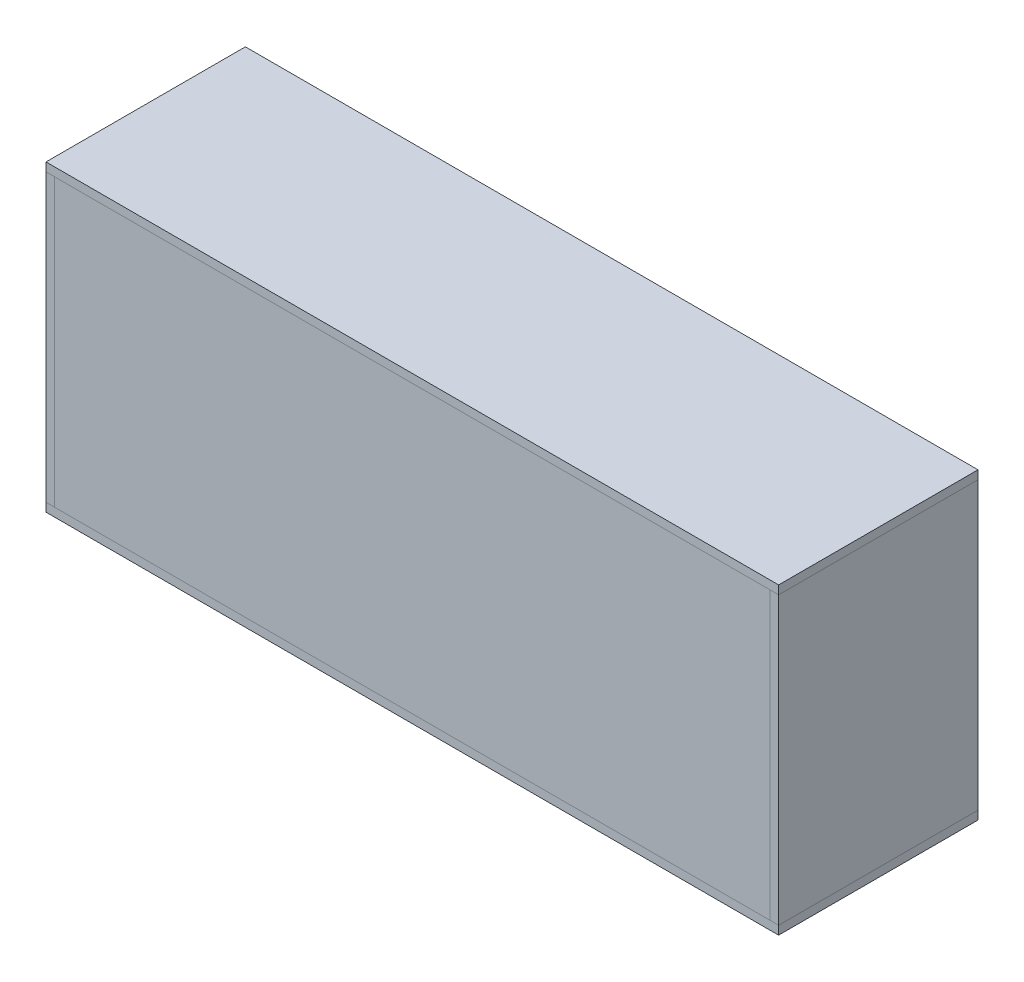
from build123d import *

# Parameters (mm, degrees)
ESQUISSE1_W             = 1536
ESQUISSE1_H             = 418
BOSS_EXTRU_1_DEPTH      = 18
ESQUISSE2_W             = 18
ESQUISSE2_H             = 418
EXTRU_MINCE3_DEPTH      = 600
ESQUISSE6_W             = 18
ESQUISSE6_H             = 418
EXTRU_MINCE4_DEPTH      = 600
ESQUISSE10_W            = 18
ESQUISSE10_H            = 600
EXTRU_MINCE5_DEPTH      = 1500
EXTRU_MINCE6_DEPTH      = 1500
ESQUISSE19_W            = 82
ESQUISSE19_H            = 18
BOSS_EXTRU_4_DEPTH      = 1500
EXTRU_MINCE7_DEPTH      = 1500
ESQUISSE13_R            = 181.9
ENL_V_MAT_EXTRU_1_DEPTH = 18
ESQUISSE14_W            = 1536
ESQUISSE14_H            = 418
BOSS_EXTRU_2_DEPTH      = 18
ESQUISSE16_W            = 18
ESQUISSE16_H            = 300
BOSS_EXTRU_3_DEPTH      = 100
BOSS_EXTRU_3_2_DEPTH    = 100


with BuildPart() as part:
    # Esquisse1 → Boss.-Extru.1 (new body)
    with BuildSketch(Plane(origin=(0, 0, 0), x_dir=(1, 0, 0), z_dir=(0, 1, 0))):
        with Locations((363.535714286, -209)):
            Rectangle(ESQUISSE1_W, ESQUISSE1_H)
    extrude(amount=BOSS_EXTRU_1_DEPTH)


with BuildPart() as body_2:
    # Esquisse2 → Extru.-Mince3 (new body)
    with BuildSketch(Plane.XZ):
        with Locations((1122.535714286, 209)):
            Rectangle(ESQUISSE2_W, ESQUISSE2_H)
    extrude(amount=EXTRU_MINCE3_DEPTH)


with BuildPart() as body_3:
    # Esquisse6 → Extru.-Mince4 (new body)
    with BuildSketch(Plane.XZ):
        with Locations((-395.464285714, 209)):
            Rectangle(ESQUISSE6_W, ESQUISSE6_H)
    extrude(amount=EXTRU_MINCE4_DEPTH)


with BuildPart() as body_4:
    # Esquisse10 → Extru.-Mince5 (new body)
    with BuildSketch(Plane(origin=(-386.464285714, 0, 0), x_dir=(0, 0, -1), z_dir=(1, 0, 0))):
        with Locations((-409, -300)):
            Rectangle(ESQUISSE10_W, ESQUISSE10_H)
    extrude(amount=EXTRU_MINCE5_DEPTH)


with BuildPart() as body_5:
    # Esquisse11 → Extru.-Mince6 (new body)
    with BuildSketch(Plane(origin=(-386.464285714, 0, 0), x_dir=(0, 0, -1), z_dir=(1, 0, 0))):
        Polygon((-400, -150), (-300, -150), (-300, -600), (-318, -600), (-318, -168), (-400, -168), align=None)
    extrude(amount=EXTRU_MINCE6_DEPTH)


with BuildPart() as body_6:
    # Esquisse19 → Boss.-Extru.4 (new body)
    with BuildSketch(Plane.ZY.offset(-1113.535714286)):
        with Locations((359, -384)):
            Rectangle(ESQUISSE19_W, ESQUISSE19_H)
    extrude(amount=BOSS_EXTRU_4_DEPTH)


with BuildPart() as body_7:
    # Esquisse12 → Extru.-Mince7 (new body)
    with BuildSketch(Plane(origin=(-386.464285714, 0, 0), x_dir=(0, 0, -1), z_dir=(1, 0, 0))):
        Polygon((0, -600), (0, -100), (-300, -100), (-300, -118), (-18, -118), (-18, -600), align=None)
    extrude(amount=EXTRU_MINCE7_DEPTH)

    # Esquisse13 → Enlèv. mat.-Extru.1 (cut)
    with BuildSketch(Plane(origin=(0, 0, 0), x_dir=(-1, 0, 0), z_dir=(0, 0, -1))):
        with Locations((-363.535714286, -341)):
            Circle(ESQUISSE13_R)
        with Locations((111.414285714, -341)):
            Circle(ESQUISSE13_R)
        with Locations((-838.485714286, -341)):
            Circle(ESQUISSE13_R)
    extrude(amount=-ENL_V_MAT_EXTRU_1_DEPTH, mode=Mode.SUBTRACT)


with BuildPart() as body_8:
    # Esquisse14 → Boss.-Extru.2 (new body)
    with BuildSketch(Plane.XZ.offset(600)):
        with Locations((363.535714286, 209)):
            Rectangle(ESQUISSE14_W, ESQUISSE14_H)
    extrude(amount=BOSS_EXTRU_2_DEPTH)


with BuildPart() as body_9:
    # Esquisse16 → Boss.-Extru.3 (new body)
    with BuildSketch(Plane(origin=(0, -100, 0), x_dir=(1, 0, 0), z_dir=(0, 1, 0))):
        with Locations((113.535714286, -150)):
            Rectangle(ESQUISSE16_W, ESQUISSE16_H)
    extrude(amount=BOSS_EXTRU_3_DEPTH)


with BuildPart() as body_10:
    # Esquisse16 → Boss.-Extru.3 2 (new body)
    with BuildSketch(Plane(origin=(0, -100, 0), x_dir=(1, 0, 0), z_dir=(0, 1, 0))):
        with Locations((613.535714286, -150)):
            Rectangle(ESQUISSE16_W, ESQUISSE16_H)
    extrude(amount=BOSS_EXTRU_3_2_DEPTH)


solid = Compound([part.part, body_2.part, body_3.part, body_4.part, body_5.part, body_6.part, body_7.part, body_8.part, body_9.part, body_10.part])
